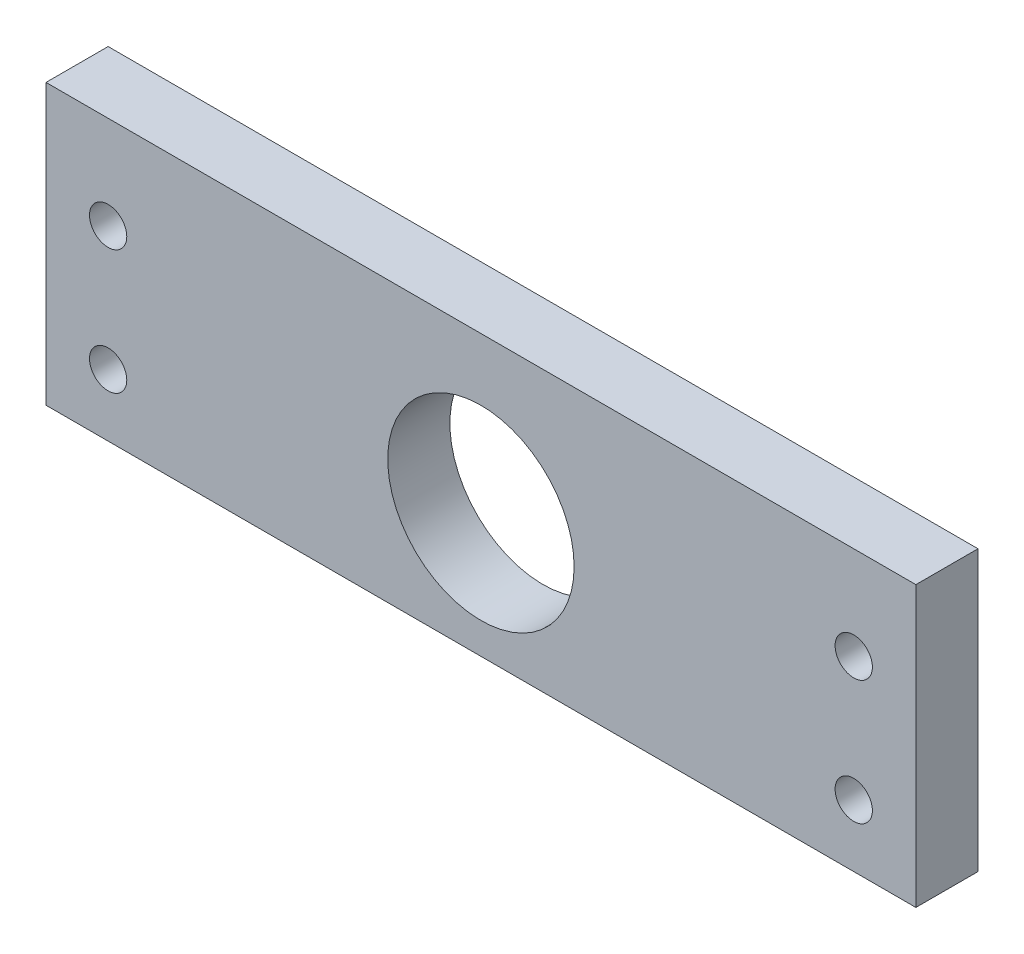
from build123d import *

# Parameters (mm, degrees)
ESQUISSE1_W        = 70
ESQUISSE1_H        = 22.5
ESQUISSE1_R        = 7.5
ESQUISSE1_R_2      = 1.5
BOSS_EXTRU_1_DEPTH = 5


with BuildPart() as part:
    # Esquisse1 → Boss.-Extru.1 (new body)
    with BuildSketch(Plane.XY):
        with Locations((0, 1.25)):
            Rectangle(ESQUISSE1_W, ESQUISSE1_H)
        Circle(ESQUISSE1_R, mode=Mode.SUBTRACT)
        with Locations((30, -5)):
            Circle(ESQUISSE1_R_2, mode=Mode.SUBTRACT)
        with Locations((30, 5)):
            Circle(ESQUISSE1_R_2, mode=Mode.SUBTRACT)
        with Locations((-30, 5)):
            Circle(ESQUISSE1_R_2, mode=Mode.SUBTRACT)
        with Locations((-30, -5)):
            Circle(ESQUISSE1_R_2, mode=Mode.SUBTRACT)
    extrude(amount=BOSS_EXTRU_1_DEPTH)


solid = part.part
